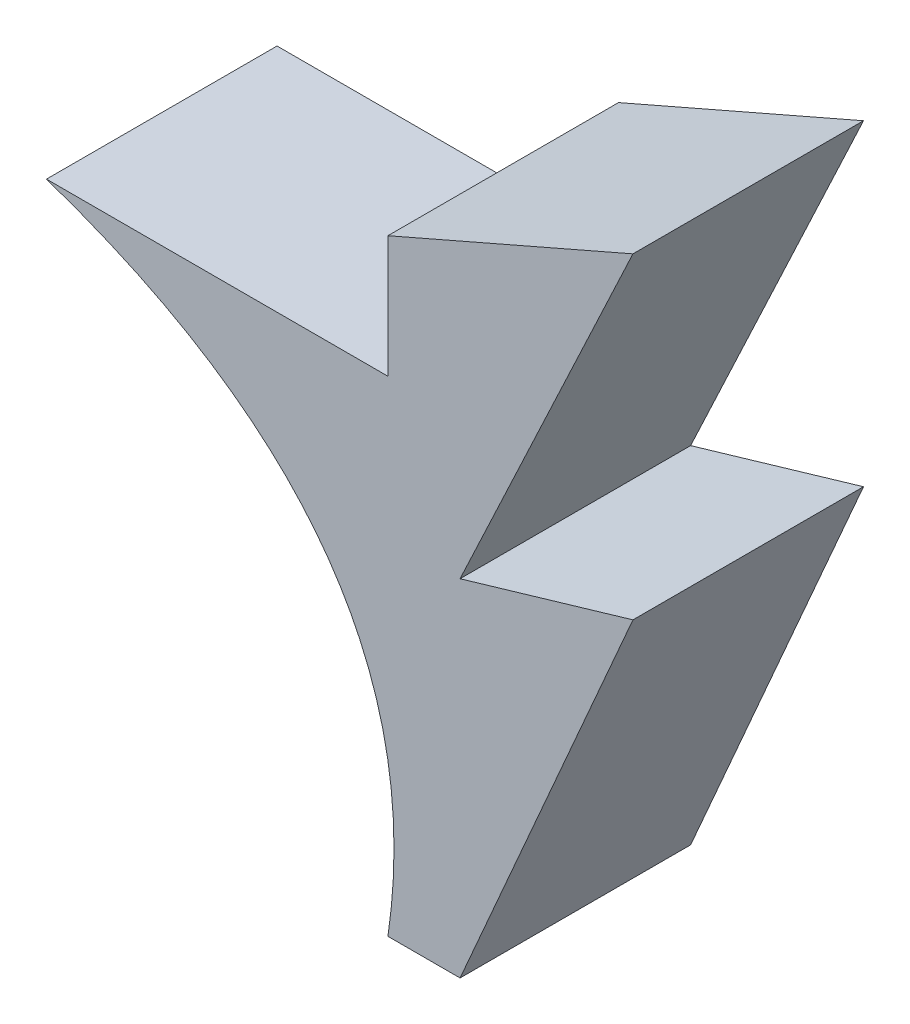
from build123d import *

# Parameters (mm, degrees)
EXTRUDE_1_DEPTH     = 50
SKETCH_2_W          = 10
SKETCH_2_H          = 10
CUT_EXTRUDE_1_DEPTH = 10


with BuildPart() as part:
    # 草圖1 → 填料-伸長1 (new body)
    with BuildSketch(Plane.XY):
        with BuildLine():
            Line((-74.049587352, 0), (0, 0))
            Line((0, 0), (0, 26.398160535))
            Line((0, 26.398160535), (53.133849001, 49.556160033))
            Line((53.133849001, 49.556160033), (15.64046603, -30.209174327))
            Line((15.64046603, -30.209174327), (53.133849001, -19.181708747))
            Line((53.133849001, -19.181708747), (15.64046603, -105.195940269))
            Line((15.64046603, -105.195940269), (0, -105.195940269))
            add(Edge.make_bspline(
                [(-74.049587352, 0), (11.284113354, -28.926204628), (0, -105.195940269)],
                knots=[0, 0, 0, 1, 1, 1], degree=2))
        make_face()
    extrude(amount=EXTRUDE_1_DEPTH)

    # 草圖2 → 除料-伸長1 (cut)
    with BuildSketch(Plane.ZY):
        with Locations((25, 5)):
            Rectangle(SKETCH_2_W, SKETCH_2_H)
    extrude(amount=-CUT_EXTRUDE_1_DEPTH, mode=Mode.SUBTRACT)


solid = part.part
